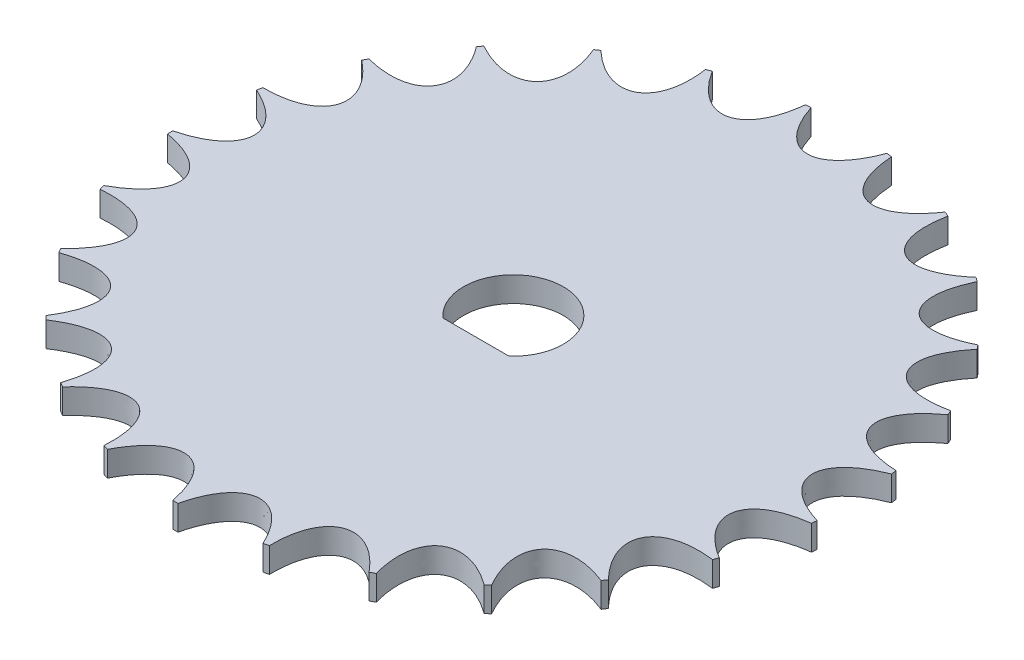
from build123d import *

# Parameters (mm, degrees)
SKETCH1_R           = 26.5
BOSS_EXTRUDE1_DEPTH = 2
CUT_EXTRUDE1_START  = -2
CUT_EXTRUDE1_DEPTH  = 2
CIRPATTERN2_COUNT   = 25
CUT_EXTRUDE2_DEPTH  = 2


with BuildPart() as part:
    # Sketch1 → Boss-Extrude1 (new body)
    with BuildSketch(Plane(origin=(0, 0, 0), x_dir=(1, 0, 0), z_dir=(0, 1, 0))):
        with Locations(Location((0, 0, 0), (0, 0, 270))):
            Circle(SKETCH1_R)
    extrude(amount=BOSS_EXTRUDE1_DEPTH)

    # Sketch2 → Cut-Extrude1 (cut)
    with BuildSketch(Plane(origin=(0, 2, 0), x_dir=(1, 0, 0), z_dir=(0, 1, 0)).offset(CUT_EXTRUDE1_START)):
        with BuildLine():
            ThreePointArc((20.67056927, 16.582447529), (18.581221902, 18.894131169), (16.234972011, 20.944586026))
            add(Edge.make_bspline(
                [(16.234972011, 20.944586026), (12.135241932, 12.33960038), (20.67056927, 16.582447529)],
                knots=[0, 0, 0, 1, 1, 1], degree=2, weights=[1, 0.580612476, 1]))
        make_face()
    cut_extrude1 = extrude(amount=CUT_EXTRUDE1_DEPTH, mode=Mode.SUBTRACT)

    # CirPattern2: Cut-Extrude1 ×25 about axis
    cirpattern2_axis = Axis((0, 2, 0), (0, -1, 0))
    for i in range(1, CIRPATTERN2_COUNT):
        add(cut_extrude1.rotate(cirpattern2_axis, i * 360 / CIRPATTERN2_COUNT), mode=Mode.SUBTRACT)

    # Sketch4 → Cut-Extrude2 (cut)
    with BuildSketch(Plane(origin=(0, 2, 0), x_dir=(1, 0, 0), z_dir=(0, 1, 0))):
        with BuildLine():
            Line((2.645751311, -3), (-2.645751311, -3))
            ThreePointArc((-2.645751311, -3), (0, 4), (2.645751311, -3))
        make_face()
    extrude(amount=-CUT_EXTRUDE2_DEPTH, mode=Mode.SUBTRACT)


solid = part.part
